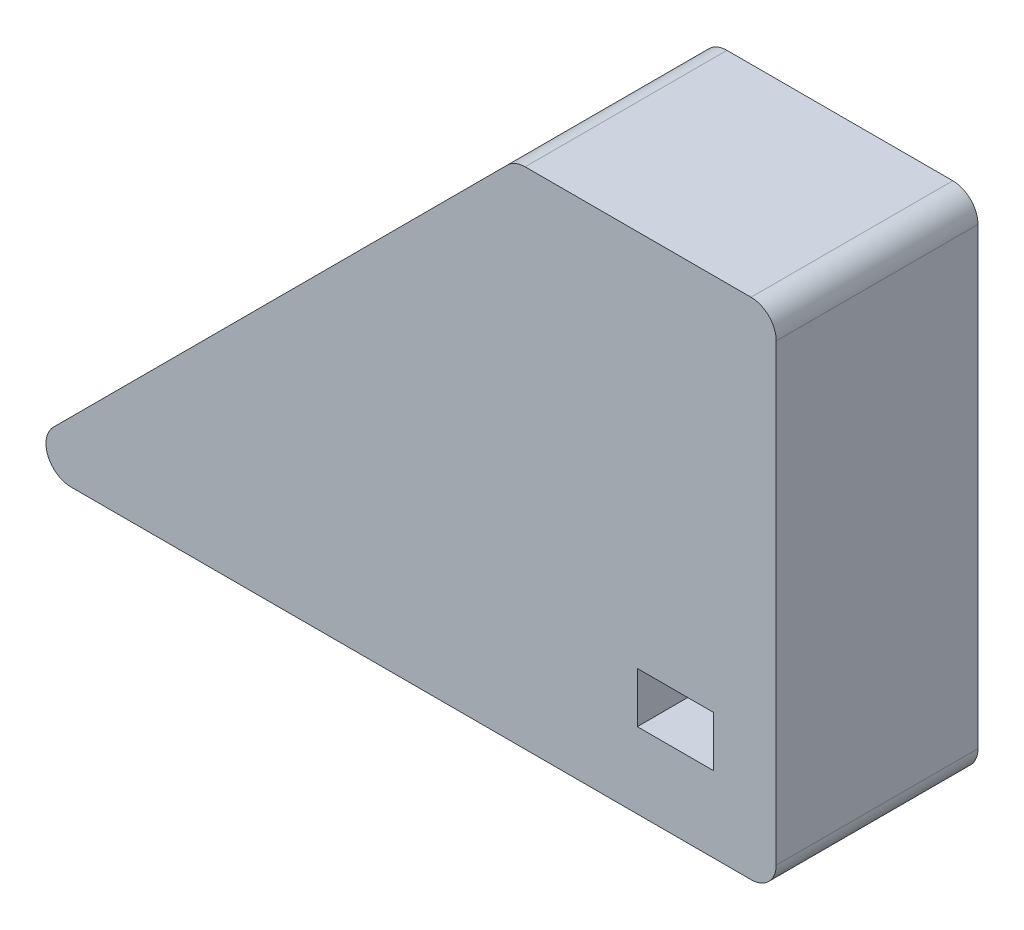
from build123d import *

# Parameters (mm, degrees)
BOSS_EXTRUDE1_DEPTH = 25.4
SKETCH3_R           = 2.4892
CUT_EXTRUDE1_DEPTH  = 25.4
SKETCH5_W           = 9.5758
SKETCH5_H           = 6.35
CUT_EXTRUDE2_DEPTH  = 17.5133
SKETCH7_R           = 4.7879
CUT_EXTRUDE3_DEPTH  = 54.61
FILLET3_R           = 3.175


with BuildPart() as part:
    # Sketch1 → Boss-Extrude1 (new body)
    with BuildSketch(Plane.XY):
        Polygon((0, 0), (63.5, 63.5), (96.42348, 63.5), (96.42348, 0), align=None)
    extrude(amount=-BOSS_EXTRUDE1_DEPTH)

    # Sketch3 → Cut-Extrude1 (cut)
    with BuildSketch(Plane.XZ):
        with Locations((83.72348, -12.7)):
            Circle(SKETCH3_R)
        with Locations((13.87348, -12.7)):
            Circle(SKETCH3_R)
    extrude(amount=-CUT_EXTRUDE1_DEPTH, mode=Mode.SUBTRACT)

    # Sketch5 → Cut-Extrude2 (cut)
    with BuildSketch(Plane.XY):
        with Locations((83.72348, 12.7)):
            Rectangle(SKETCH5_W, SKETCH5_H)
    extrude(amount=-CUT_EXTRUDE2_DEPTH, mode=Mode.SUBTRACT)

    # Sketch7 → Cut-Extrude3 (cut)
    with BuildSketch(Plane(origin=(0, 63.5, 0), x_dir=(1, 0, 0), z_dir=(0, 1, 0))):
        with Locations(Location((13.87348, 12.7, 0), (0, 0, 270))):
            Circle(SKETCH7_R)
    extrude(amount=-CUT_EXTRUDE3_DEPTH, mode=Mode.SUBTRACT)

    # Fillet3
    fillet3_edges = [part.edges().sort_by_distance(p)[0] for p in [
        (0, 0, -12.7),
        (63.5, 63.5, -12.7),
        (96.42348, 63.5, -12.7),
        (96.42348, 0, -12.7),
    ]]
    fillet(fillet3_edges, radius=FILLET3_R)


solid = part.part
